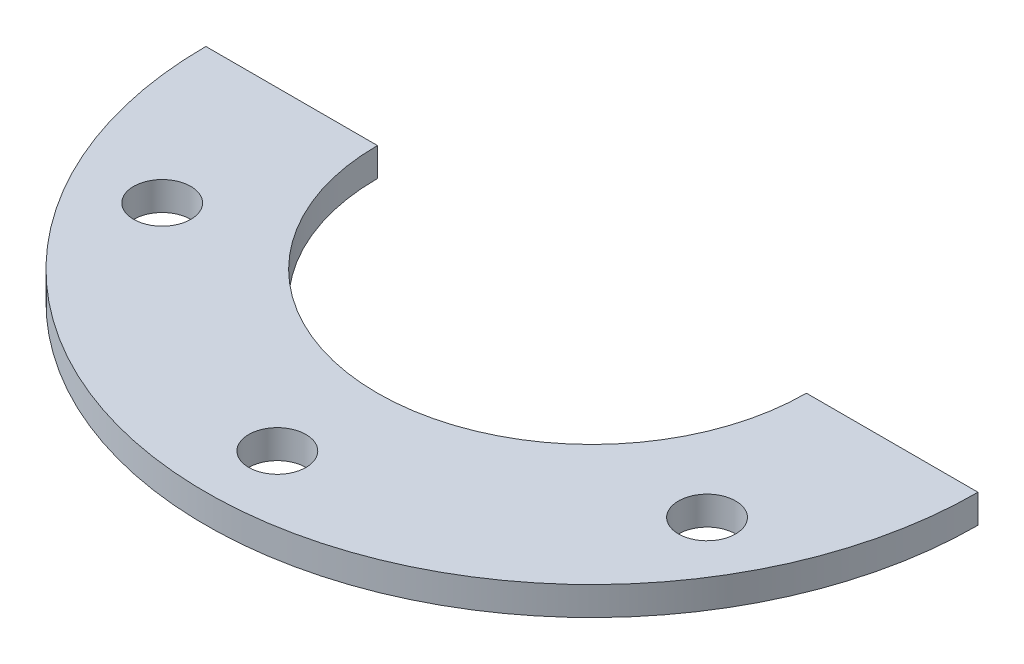
from build123d import *

# Parameters (mm, degrees)
SKETCH1_R               = 13.5
BOSS_EXTRUDE1_DEPTH     = 1
CUT_EXTRUDE1_DEPTH      = 20.118054294
CUT_EXTRUDE1_DEPTH_BACK = 20.118054294
SKETCH19_R              = 1
CUT_EXTRUDE2_DEPTH      = 20.118054294
CUT_EXTRUDE2_DEPTH_BACK = 20.118054294
SKETCH20_R              = 7.5
SKETCH21_W              = 65.874202484
SKETCH21_H              = 51.979273979
CUT_EXTRUDE3_DEPTH      = 20.118054294


with BuildPart() as part:
    # Sketch1 → Boss-Extrude1 (new body)
    with BuildSketch(Plane(origin=(0, 0, 0), x_dir=(1, 0, 0), z_dir=(0, 1, 0))):
        with Locations(Location((0, 0, 0), (0, 0, 270))):
            Circle(SKETCH1_R)
    extrude(amount=BOSS_EXTRUDE1_DEPTH)

    # Sketch19 → Cut-Extrude1 (cut, two sides: drawn at the far end of the back side and taken through both)
    with BuildSketch(Plane(origin=(0, 1, 0), x_dir=(1, 0, 0), z_dir=(0, 1, 0)).offset(-CUT_EXTRUDE1_DEPTH_BACK)):
        with Locations(Location((0, 11, 0), (0, 0, 270))):
            Circle(SKETCH19_R)
        with Locations(Location((9.526279442, 5.5, 0), (0, 0, 270))):
            Circle(SKETCH19_R)
        with Locations(Location((9.526279442, -5.5, 0), (0, 0, 270))):
            Circle(SKETCH19_R)
        with Locations(Location((0, -11, 0), (0, 0, 270))):
            Circle(SKETCH19_R)
        with Locations(Location((-9.526279442, -5.5, 0), (0, 0, 270))):
            Circle(SKETCH19_R)
        with Locations(Location((-9.526279442, 5.5, 0), (0, 0, 270))):
            Circle(SKETCH19_R)
    extrude(amount=CUT_EXTRUDE1_DEPTH + CUT_EXTRUDE1_DEPTH_BACK, mode=Mode.SUBTRACT)

    # Sketch20 → Cut-Extrude2 (cut, two sides: drawn at the far end of the back side and taken through both)
    with BuildSketch(Plane(origin=(0, 1, 0), x_dir=(1, 0, 0), z_dir=(0, 1, 0)).offset(-CUT_EXTRUDE2_DEPTH_BACK)):
        with Locations(Location((0, 0, 0), (0, 0, 270))):
            Circle(SKETCH20_R)
    extrude(amount=CUT_EXTRUDE2_DEPTH + CUT_EXTRUDE2_DEPTH_BACK, mode=Mode.SUBTRACT)

    # Sketch21 → Cut-Extrude3 (cut, through all)
    with BuildSketch(Plane.XY):
        with Locations((-3.816154381, 6.321647006)):
            Rectangle(SKETCH21_W, SKETCH21_H)
    extrude(amount=-CUT_EXTRUDE3_DEPTH, mode=Mode.SUBTRACT)


solid = part.part
